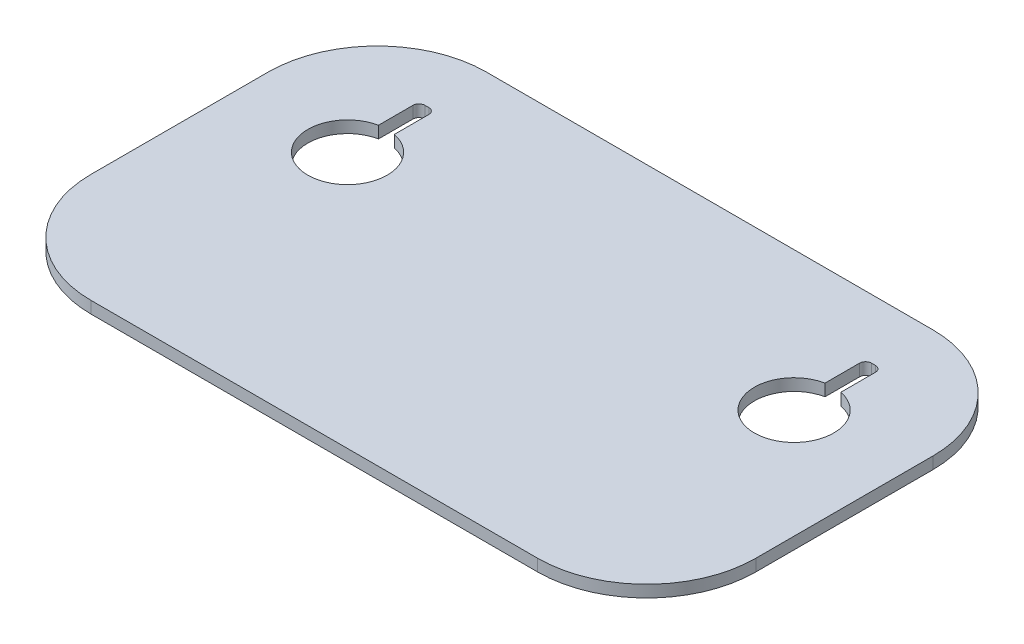
from build123d import *

# Parameters (mm, degrees)
BOSS_EXTRUDE1_DEPTH = 6
CUT_EXTRUDE2_DEPTH  = 280


with BuildPart() as part:
    # Sketch1 → Boss-Extrude1 (new body)
    with BuildSketch(Plane(origin=(0, 0, 0), x_dir=(1, 0, 0), z_dir=(0, 1, 0))):
        with BuildLine():
            Line((-9.966577693, 27.987014401), (215.063422307, 27.987014401))
            ThreePointArc((215.063422307, 27.987014401), (253.954295273, 11.877887367), (270.063422307, -27.012985599))
            Line((270.063422307, -27.012985599), (270.063422307, -116.272985599))
            ThreePointArc((270.063422307, -116.272985599), (253.954295273, -155.163858564), (215.063422307, -171.272985599))
            Line((215.063422307, -171.272985599), (-9.966577693, -171.272985599))
            ThreePointArc((-9.966577693, -171.272985599), (-48.857450658, -155.163858564), (-64.966577693, -116.272985599))
            Line((-64.966577693, -116.272985599), (-64.966577693, -27.012985599))
            ThreePointArc((-64.966577693, -27.012985599), (-48.857450658, 11.877887367), (-9.966577693, 27.987014401))
        make_face()
    extrude(amount=BOSS_EXTRUDE1_DEPTH)

    # Sketch3 → Cut-Extrude2 (cut)
    with BuildSketch(Plane(origin=(0, 6, 0), x_dir=(1, 0, 0), z_dir=(0, 1, 0))):
        with BuildLine():
            Line((-10.966577693, -2.012985599), (-8.966577693, -2.012985599))
            ThreePointArc((-8.966577693, -2.012985599), (-6.845257349, -2.891665255), (-5.966577693, -5.012985599))
            Line((-5.966577693, -5.012985599), (-5.966577693, -22.417067656))
            ThreePointArc((-5.966577693, -22.417067656), (-9.966577693, -62.012985599), (-13.966577693, -22.417067656))
            Line((-13.966577693, -22.417067656), (-13.966577693, -5.012985599))
            ThreePointArc((-13.966577693, -5.012985599), (-13.087898036, -2.891665255), (-10.966577693, -2.012985599))
        make_face()
        with BuildLine():
            Line((214.063422307, -2.012985599), (216.063422307, -2.012985599))
            ThreePointArc((216.063422307, -2.012985599), (218.184742651, -2.891665255), (219.063422307, -5.012985599))
            Line((219.063422307, -5.012985599), (219.063422307, -22.417067656))
            ThreePointArc((219.063422307, -22.417067656), (215.063422307, -62.012985599), (211.063422307, -22.417067656))
            Line((211.063422307, -22.417067656), (211.063422307, -5.012985599))
            ThreePointArc((211.063422307, -5.012985599), (211.942101964, -2.891665255), (214.063422307, -2.012985599))
        make_face()
    extrude(amount=-CUT_EXTRUDE2_DEPTH, mode=Mode.SUBTRACT)


solid = part.part
